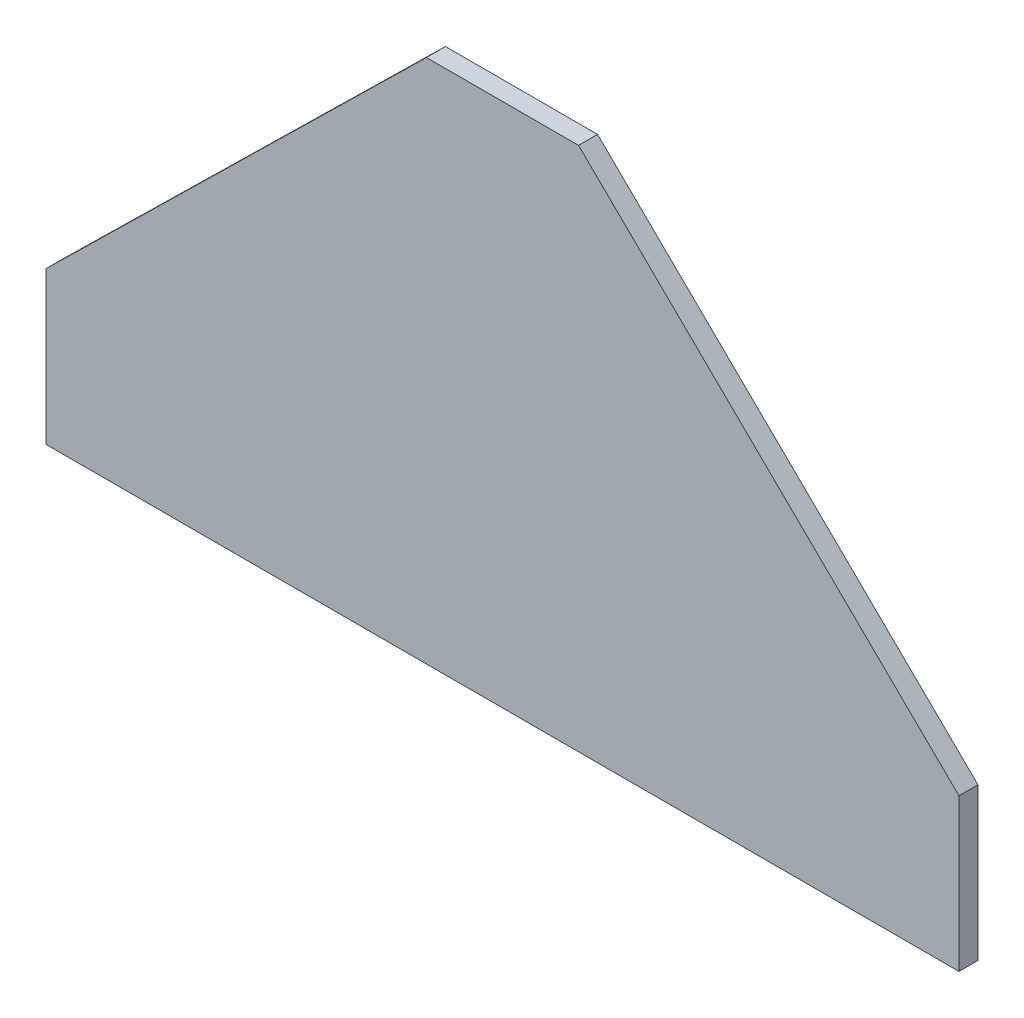
from build123d import *

# Parameters (mm, degrees)
BOSS_EXTRUDE1_DEPTH = 6.35


with BuildPart() as part:
    # Sketch1 → Boss-Extrude1 (new body)
    with BuildSketch(Plane.XY):
        Polygon((85.360109381, 96.566728588), (136.160109381, 96.566728588), (263.160109381, -27.976489364), (263.160109381, -78.776489364), (-41.639890619, -78.776489364), (-41.639890619, -27.976489364), align=None)
    extrude(amount=BOSS_EXTRUDE1_DEPTH)


solid = part.part
